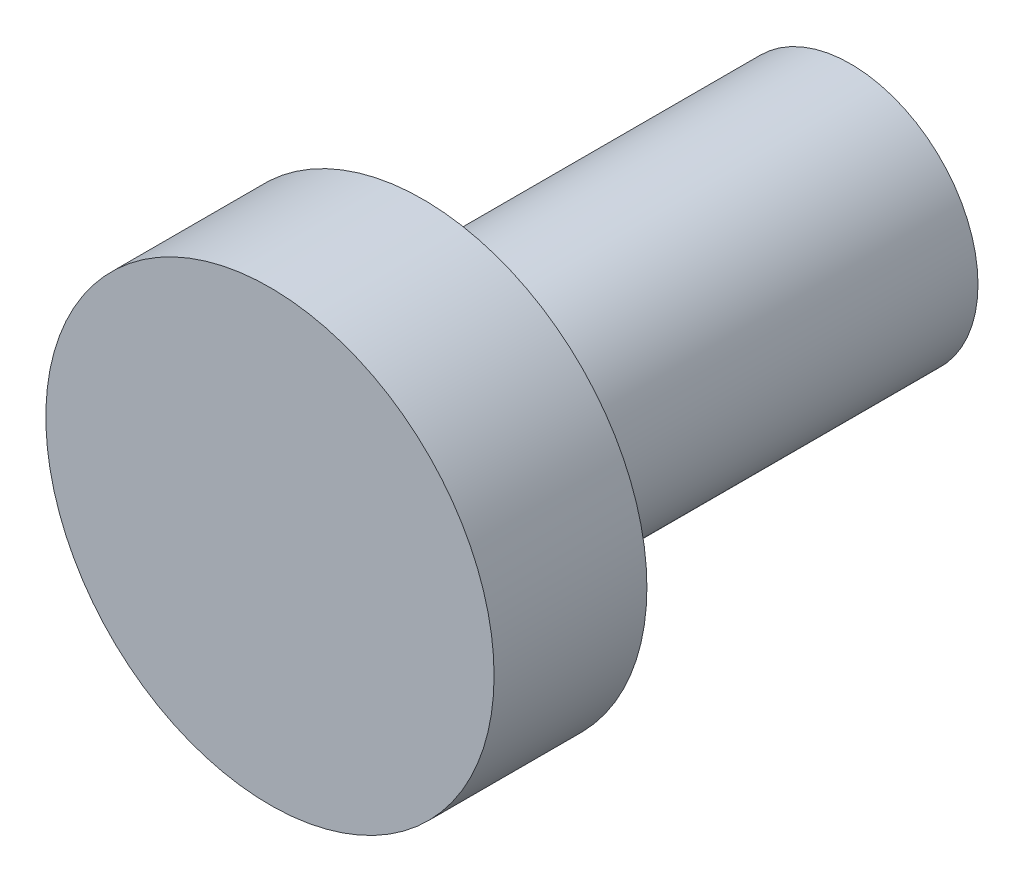
from build123d import *

# Parameters (mm, degrees)
SKETCH_1_R        = 1.25
M2P5_DEPTH        = 4.2
EXTRUDE_START     = 4.2
SKETCH_2_R        = 2.2
EXTRUDE_265_DEPTH = 1.5


with BuildPart() as part:
    # 草图1 → M2p5转轴简化杆 (new body)
    with BuildSketch(Plane.XY):
        Circle(SKETCH_1_R)
    extrude(amount=M2P5_DEPTH)

    # 草图2 → Extrude 265 (add)
    with BuildSketch(Plane.XY.offset(EXTRUDE_START)):
        Circle(SKETCH_2_R)
    extrude(amount=EXTRUDE_265_DEPTH)


solid = part.part
